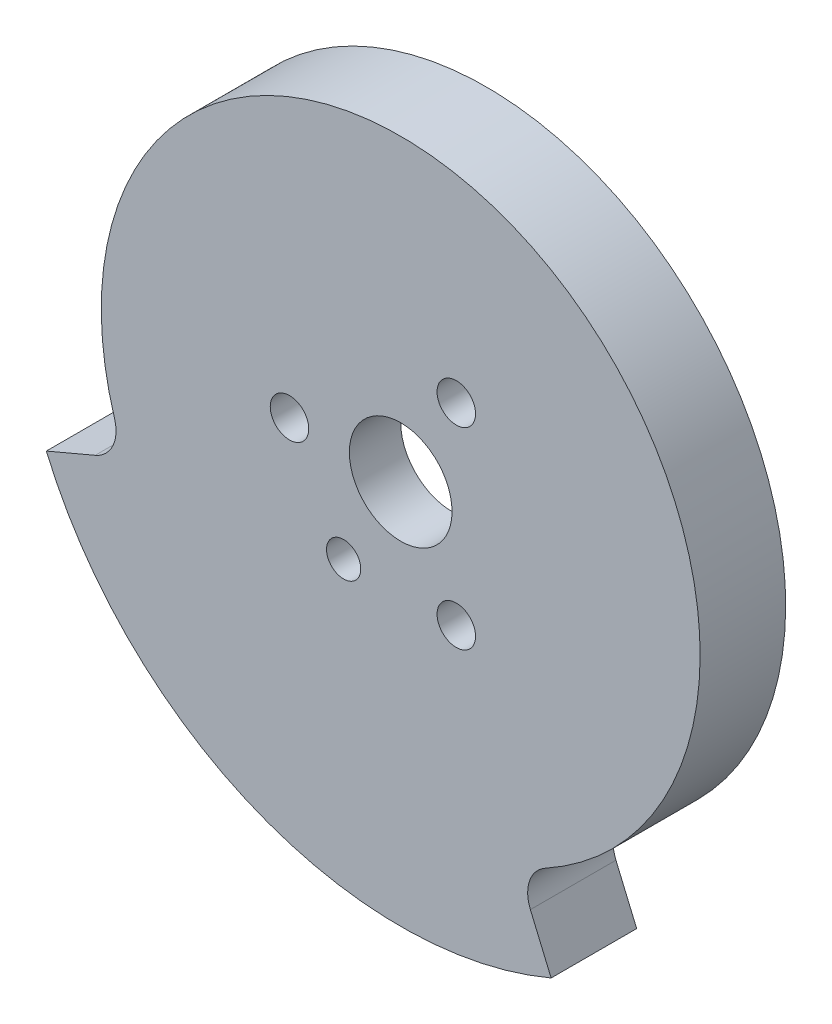
from build123d import *

# Parameters (mm, degrees)
ESQUISSE1_R             = 2.25
ESQUISSE1_R_2           = 6
ESQUISSE1_R_3           = 2
EXTRUSION1_DEPTH        = 10
ESQUISSE2_R             = 25
ENL_V_MAT_EXTRU_1_DEPTH = 4


with BuildPart() as part:
    # Esquisse1 → Extrusion1 (new body)
    with BuildSketch(Plane.XY):
        with BuildLine():
            Line((15.158152138, -35.710368575), (17.582900782, -41.422718405))
            ThreePointArc((17.582900782, -41.422718405), (-16.857296704, -41.723273456), (-41.422718405, -17.582900782))
            Line((-41.422718405, -17.582900782), (-35.710368575, -15.158152138))
            ThreePointArc((-35.710368575, -15.158152138), (-33.646394386, -13.163025073), (-33.450391234, -10.29909347))
            ThreePointArc((-33.450391234, -10.29909347), (13.11123077, 32.45143491), (16.907846264, -30.645142106))
            ThreePointArc((16.907846264, -30.645142106), (15.059385072, -32.841437324), (15.158152138, -35.710368575))
        make_face()
        with Locations((-13, 0)):
            Circle(ESQUISSE1_R, mode=Mode.SUBTRACT)
        with Locations((6.5, 11.258330249)):
            Circle(ESQUISSE1_R, mode=Mode.SUBTRACT)
        with Locations((6.5, -11.258330249)):
            Circle(ESQUISSE1_R, mode=Mode.SUBTRACT)
        Circle(ESQUISSE1_R_2, mode=Mode.SUBTRACT)
        with Locations((-6.670127311, -11.158378093)):
            Circle(ESQUISSE1_R_3, mode=Mode.SUBTRACT)
    extrude(amount=EXTRUSION1_DEPTH)

    # Esquisse2 → Enlèv. mat.-Extru.1 (cut)
    with BuildSketch(Plane(origin=(0, 0, 0), x_dir=(-1, 0, 0), z_dir=(0, 0, -1))):
        Circle(ESQUISSE2_R)
    extrude(amount=-ENL_V_MAT_EXTRU_1_DEPTH, mode=Mode.SUBTRACT)


solid = part.part
